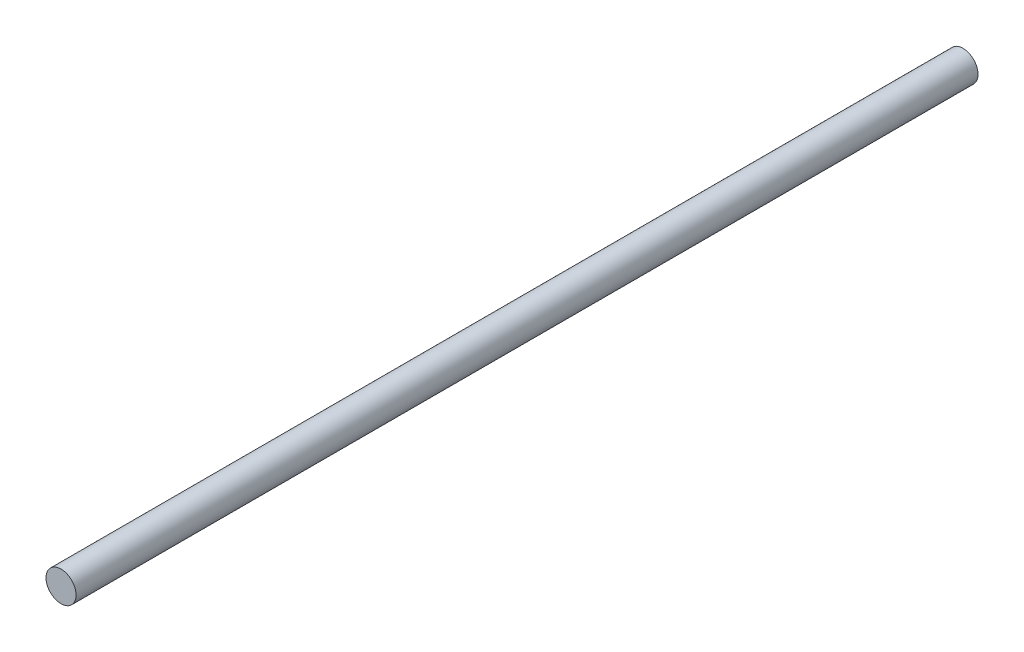
from build123d import *

# Parameters (mm, degrees)
SKETCH1_R           = 3
BOSS_EXTRUDE1_DEPTH = 90


with BuildPart() as part:
    # Sketch1 → Boss-Extrude1 (new, symmetric)
    with BuildSketch(Plane.XY):
        with Locations(Location((0, 0, 0), (0, 0, 180))):
            Circle(SKETCH1_R)
    extrude(amount=BOSS_EXTRUDE1_DEPTH, both=True)


solid = part.part
